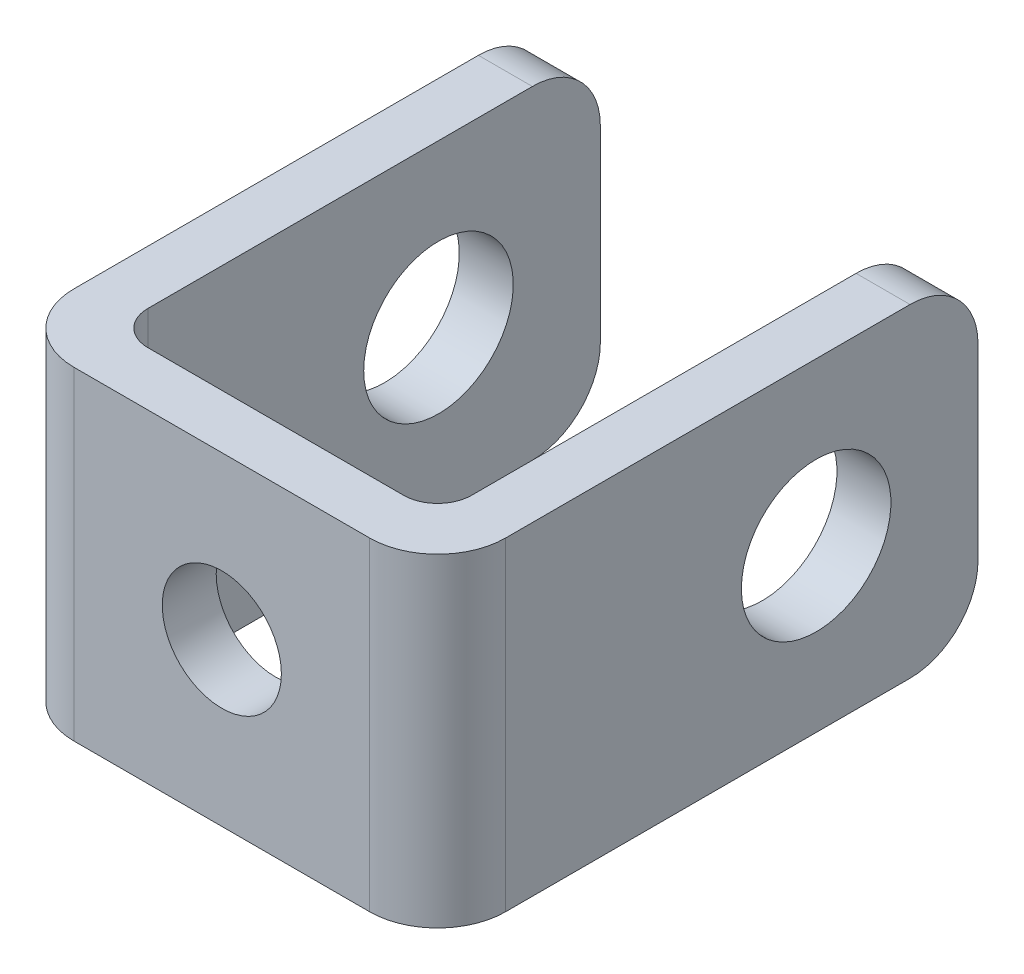
from build123d import *

# Parameters (mm, degrees)
EXTRUDE_THIN1_DEPTH = 9.525
FILLET1_R           = 1
FILLET3_R           = 2
FILLET4_R           = 2
SKETCH2_R           = 2.2
CUT_EXTRUDE1_DEPTH  = 23.468607993
CUT_EXTRUDE2_REACH  = 24.469
SKETCH3_R           = 1.7525


with BuildPart() as part:
    # Sketch1 → Extrude-Thin1 (new body)
    with BuildSketch(Plane(origin=(0, 0, 0), x_dir=(1, 0, 0), z_dir=(0, 1, 0))):
        Polygon((0, 0), (0, -15.9004), (12.7, -15.9004), (12.7, 0), (11.1125, 0), (11.1125, -14.3129), (1.5875, -14.3129), (1.5875, 0), align=None)
    extrude(amount=EXTRUDE_THIN1_DEPTH)

    # Fillet1
    fillet1_edges = [part.edges().sort_by_distance(p)[0] for p in [
        (1.5875, 4.7625, 14.3129),
        (11.1125, 4.7625, 14.3129),
    ]]
    fillet(fillet1_edges, radius=FILLET1_R)

    # Fillet3
    fillet3_edges = [part.edges().sort_by_distance(p)[0] for p in [
        (12.7, 4.7625, 15.9004),
        (0, 4.7625, 15.9004),
    ]]
    fillet(fillet3_edges, radius=FILLET3_R)

    # Fillet4
    fillet4_edges = [part.edges().sort_by_distance(p)[0] for p in [
        (0.79375, 9.525, 0),
        (0.79375, 0, 0),
        (11.90625, 9.525, 0),
        (11.90625, 0, 0),
    ]]
    fillet(fillet4_edges, radius=FILLET4_R)

    # Sketch2 → Cut-Extrude1 (cut, through all)
    with BuildSketch(Plane.ZY):
        with Locations((4.7625, 4.7625)):
            Circle(SKETCH2_R)
    extrude(amount=-CUT_EXTRUDE1_DEPTH, mode=Mode.SUBTRACT)

    # Sketch3 → Cut-Extrude2 (cut, up to next)
    with BuildSketch(Plane.XY.offset(15.9004), mode=Mode.PRIVATE) as cut_extrude2_sk1:
        with Locations((6.35, 4.7625)):
            Circle(SKETCH3_R)
    cut_extrude2_tool1 = extrude(cut_extrude2_sk1.sketch, amount=-CUT_EXTRUDE2_REACH, mode=Mode.PRIVATE) & part.part
    add(cut_extrude2_tool1.solids().sort_by_distance((6.35, 4.7625, 15.9004))[0], mode=Mode.SUBTRACT)


solid = part.part
